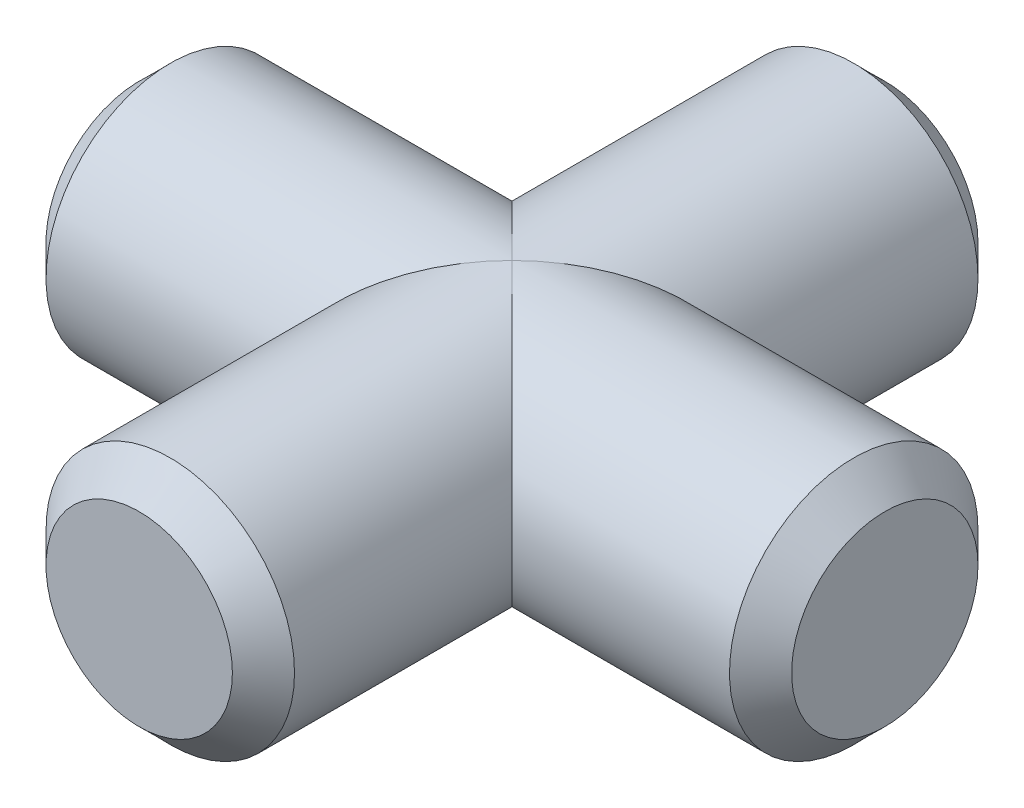
from build123d import *

# Parameters (mm, degrees)
SKETCH1_R           = 2
BOSS_EXTRUDE1_DEPTH = 12
SKETCH3_R           = 2
BOSS_EXTRUDE2_DEPTH = 6
CHAMFER1_SIZE       = 0.5
CHAMFER2_SIZE       = 0.5


with BuildPart() as part:
    # Sketch1 → Boss-Extrude1 (new body)
    with BuildSketch(Plane.XY):
        Circle(SKETCH1_R)
    extrude(amount=BOSS_EXTRUDE1_DEPTH)

    # Sketch3 → Boss-Extrude2 (add, symmetric)
    with BuildSketch(Plane(origin=(0, 0, 0), x_dir=(0, 0, -1), z_dir=(1, 0, 0))):
        with Locations(Location((-6, 0, 0), (0, 0, 270))):
            Circle(SKETCH3_R)
    extrude(amount=BOSS_EXTRUDE2_DEPTH, both=True)

    # Chamfer1
    chamfer1_edges = [part.edges().sort_by_distance(p)[0] for p in [
        (6, 2, 6),
    ]]
    chamfer(chamfer1_edges, length=CHAMFER1_SIZE)

    # Chamfer2
    chamfer2_edges = [part.edges().sort_by_distance(p)[0] for p in [
        (-2, 0, 0),
        (-2, 0, 12),
        (-6, 2, 6),
    ]]
    chamfer(chamfer2_edges, length=CHAMFER2_SIZE)


solid = part.part
